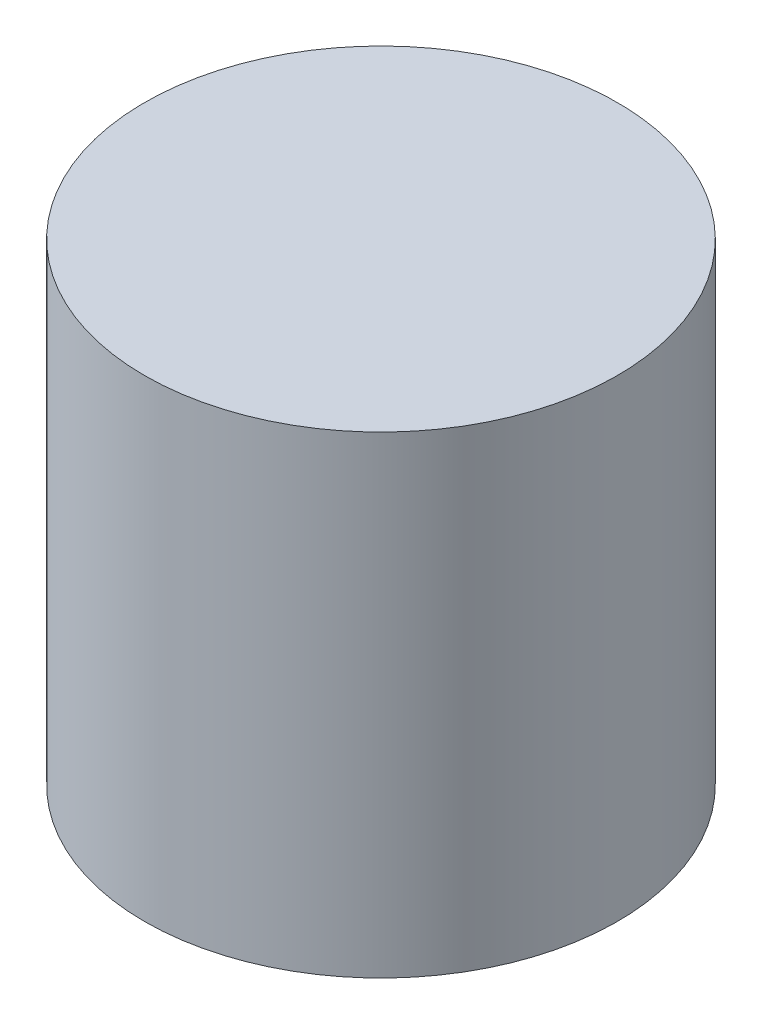
from build123d import *

# Parameters (mm, degrees)
SKETCH1_R           = 0.635
BOSS_EXTRUDE1_DEPTH = 1.27


with BuildPart() as part:
    # Sketch1 → Boss-Extrude1 (new body)
    with BuildSketch(Plane(origin=(0, 0, 0), x_dir=(1, 0, 0), z_dir=(0, 1, 0))):
        with Locations(Location((0, 0, 0), (0, 0, 270))):
            Circle(SKETCH1_R)
    extrude(amount=BOSS_EXTRUDE1_DEPTH)


solid = part.part
